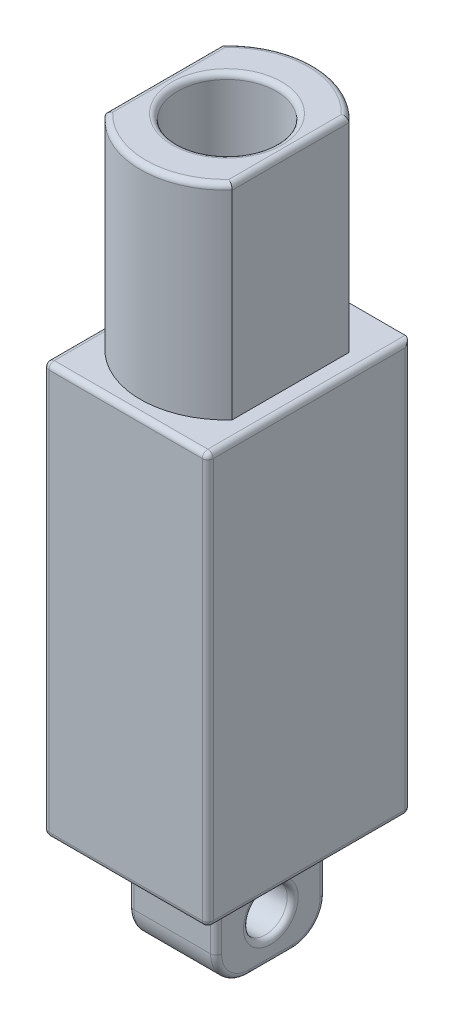
from build123d import *

# Parameters (mm, degrees)
SKETCH1_W           = 15
SKETCH1_H           = 18.5
BOSS_EXTRUDE1_DEPTH = 37.5
SKETCH2_W           = 8
SKETCH2_H           = 9.997224294
BOSS_EXTRUDE2_DEPTH = 9
SKETCH3_W           = 11.6
SKETCH3_H           = 10.65
BOSS_EXTRUDE3_DEPTH = 18.65
SKETCH4_R           = 4.5
CUT_EXTRUDE1_DEPTH  = 20.32
CUT_EXTRUDE2_REACH  = 60.057
SKETCH5_R           = 2
FILLET1_R           = 3
FILLET2_R           = 0.5
FILLET3_R           = 0.5


with BuildPart() as part:
    # Sketch1 → Boss-Extrude1 (new body)
    with BuildSketch(Plane(origin=(0, 0, 0), x_dir=(1, 0, 0), z_dir=(0, 1, 0))):
        Rectangle(SKETCH1_W, SKETCH1_H)
    extrude(amount=BOSS_EXTRUDE1_DEPTH)

    # Sketch2 → Boss-Extrude2 (add)
    with BuildSketch(Plane.XZ):
        Rectangle(SKETCH2_W, SKETCH2_H)
    extrude(amount=BOSS_EXTRUDE2_DEPTH)

    # Sketch3 → Boss-Extrude3 (add)
    with BuildSketch(Plane(origin=(0, 37.5, 0), x_dir=(1, 0, 0), z_dir=(0, 1, 0))):
        with BuildLine():
            ThreePointArc((-5.8, 5.325), (0, 7.9), (5.8, 5.325))
            Line((5.8, 5.325), (-5.8, 5.325))
        make_face()
        Rectangle(SKETCH3_W, SKETCH3_H)
        with BuildLine():
            ThreePointArc((-5.8, -5.325), (0, -7.9), (5.8, -5.325))
            Line((5.8, -5.325), (-5.8, -5.325))
        make_face()
    extrude(amount=BOSS_EXTRUDE3_DEPTH)

    # Sketch4 → Cut-Extrude1 (cut)
    with BuildSketch(Plane(origin=(0, 56.15, 0), x_dir=(1, 0, 0), z_dir=(0, 1, 0))):
        with Locations(Location((0, 0, 0), (0, 0, 270))):
            Circle(SKETCH4_R)
    extrude(amount=-CUT_EXTRUDE1_DEPTH, mode=Mode.SUBTRACT)

    # Sketch5 → Cut-Extrude2 (cut, up to next)
    with BuildSketch(Plane.ZY.offset(4), mode=Mode.PRIVATE) as cut_extrude2_sk1:
        with Locations((0, -5)):
            Circle(SKETCH5_R)
    cut_extrude2_tool1 = extrude(cut_extrude2_sk1.sketch, amount=-CUT_EXTRUDE2_REACH, mode=Mode.PRIVATE) & part.part
    add(cut_extrude2_tool1.solids().sort_by_distance((-4, -5, 0))[0], mode=Mode.SUBTRACT)

    # Fillet1
    fillet1_edges = [part.edges().sort_by_distance(p)[0] for p in [
        (0, -9, 4.998612147),
        (0, -9, -4.998612147),
    ]]
    fillet(fillet1_edges, radius=FILLET1_R)

    # Fillet2
    fillet2_edges = [part.edges().sort_by_distance(p)[0] for p in [
        (-7.5, 37.5, 0),
        (4, 0, 0),
        (0, 0, 4.998612147),
        (-4, 0, 0),
        (0, 0, -4.998612147),
        (0, 37.5, 9.25),
        (-4, -5, -2),
        (4, -5, -2),
        (4, -9, 0),
        (-4, -9, 0),
        (7.5, 37.5, 0),
        (0, 0, 9.25),
        (4, -3, 4.998612147),
        (4, -3, -4.998612147),
        (4, -8.121320344, 4.119932491),
        (4, -8.121320344, -4.119932491),
        (-4, -3, -4.998612147),
        (-4, -3, 4.998612147),
        (-4, -8.121320344, 4.119932491),
        (-4, -8.121320344, -4.119932491),
        (-7.5, 0, 0),
        (0, 0, -9.25),
        (7.5, 0, 0),
        (7.5, 18.75, 9.25),
        (-7.5, 18.75, 9.25),
        (-7.5, 18.75, -9.25),
        (7.5, 18.75, -9.25),
    ]]
    fillet(fillet2_edges, radius=FILLET2_R)

    # Fillet3
    fillet3_edges = [part.edges().sort_by_distance(p)[0] for p in [
        (0, 56.15, -7.9),
        (-5.8, 56.15, 0),
        (0, 56.15, 7.9),
        (5.8, 56.15, 0),
        (0, 56.15, -4.5),
    ]]
    fillet(fillet3_edges, radius=FILLET3_R)


solid = part.part
